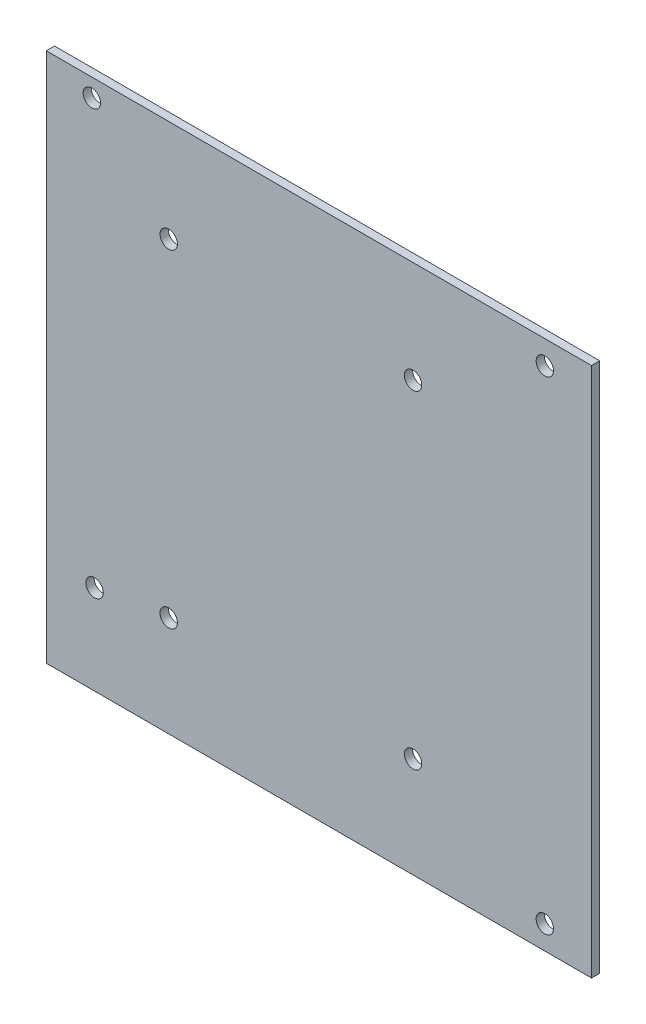
from build123d import *

# Parameters (mm, degrees)
SKETCH_1_W      = 99.3
SKETCH_1_H      = 96.6
SKETCH_1_R      = 1.585
EXTRUDE_1_DEPTH = 1.5


with BuildPart() as part:
    # 草图1 → 凸台-拉伸1 (new body)
    with BuildSketch(Plane.XY):
        with Locations((31.77, 34.42)):
            Rectangle(SKETCH_1_W, SKETCH_1_H)
        with Locations((48.92, 64.16)):
            Circle(SKETCH_1_R, mode=Mode.SUBTRACT)
        with Locations((4.42, 64.16)):
            Circle(SKETCH_1_R, mode=Mode.SUBTRACT)
        with Locations((4.42, 4.42)):
            Circle(SKETCH_1_R, mode=Mode.SUBTRACT)
        with Locations((48.92, 4.42)):
            Circle(SKETCH_1_R, mode=Mode.SUBTRACT)
        with Locations((-9.08, 2.42)):
            Circle(SKETCH_1_R, mode=Mode.SUBTRACT)
        with Locations((72.92, -9.58)):
            Circle(SKETCH_1_R, mode=Mode.SUBTRACT)
        with Locations((72.92, 78.42)):
            Circle(SKETCH_1_R, mode=Mode.SUBTRACT)
        with Locations((-9.58, 79.42)):
            Circle(SKETCH_1_R, mode=Mode.SUBTRACT)
    extrude(amount=EXTRUDE_1_DEPTH)


solid = part.part
